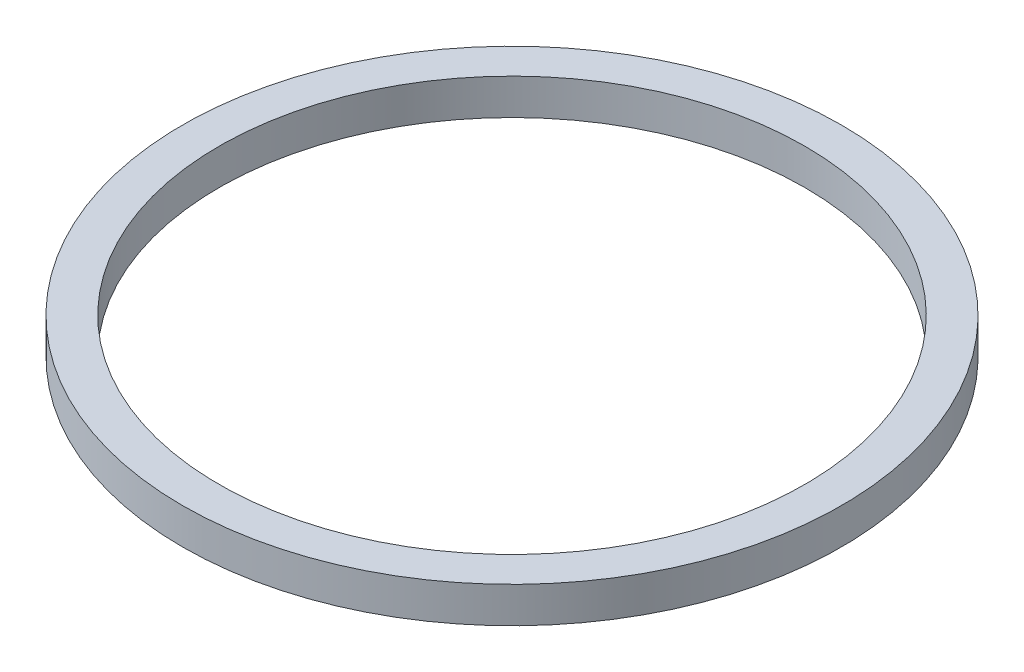
from build123d import *

# Parameters (mm, degrees)
SKETCH1_W = 7.5
SKETCH1_H = 7.3475


with BuildPart() as part:
    # Sketch1 → Revolve1 (revolve)
    with BuildSketch(Plane.XY, mode=Mode.PRIVATE) as revolve1_sk:
        with Locations((-63.75, 4.45875)):
            Rectangle(SKETCH1_W, SKETCH1_H)
    revolve(revolve1_sk.sketch.rotate(Axis((0, -200069.047495165, 0), (0, 1, 0)), 270), axis=Axis((0, -200069.047495165, 0), (0, 1, 0)))


solid = part.part
